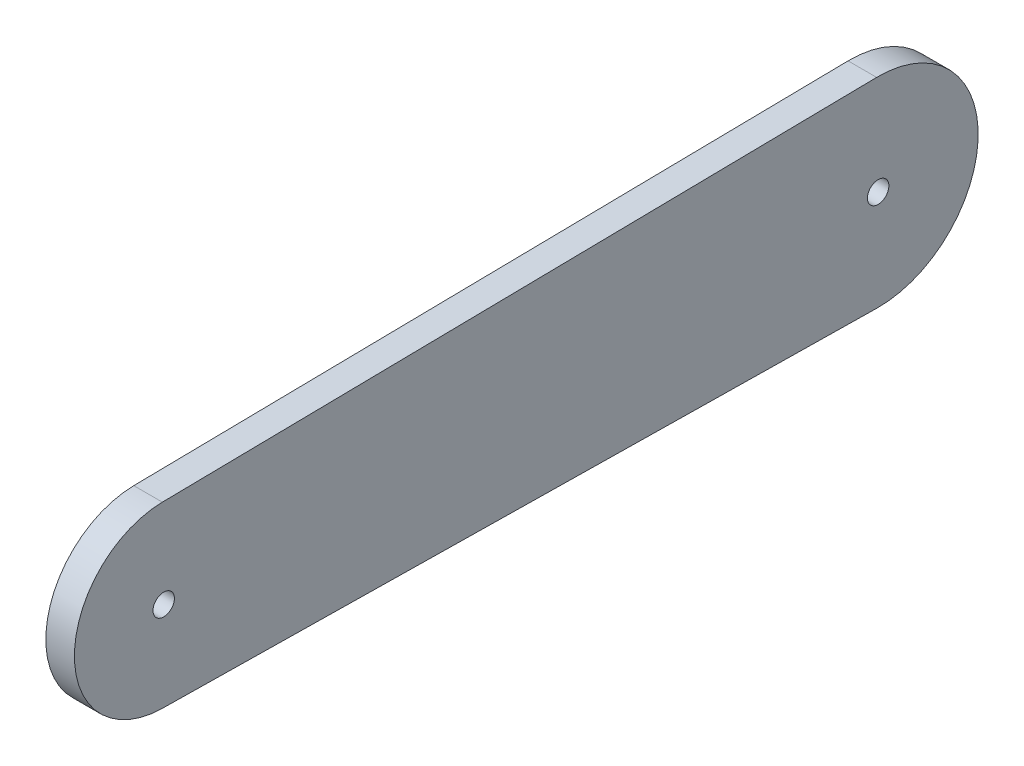
from build123d import *

# Parameters (mm, degrees)
CROQUIS1_R              = 1.5
SALIENTE_EXTRUIR1_DEPTH = 4


with BuildPart() as part:
    # Croquis1 → Saliente-Extruir1 (new body)
    with BuildSketch(Plane(origin=(0, 0, 0), x_dir=(0, 0, -1), z_dir=(1, 0, 0))):
        with BuildLine():
            Line((-100.1875, 12.498593671), (-0.21, 13.998424911))
            ThreePointArc((-0.21, 13.998424911), (14, 0), (-0.21, -13.998424911))
            Line((-0.21, -13.998424911), (-100.1875, -12.498593671))
            ThreePointArc((-100.1875, -12.498593671), (-112.5, 0), (-100.1875, 12.498593671))
        make_face()
        Circle(CROQUIS1_R, mode=Mode.SUBTRACT)
        with Locations((-100, 0)):
            Circle(CROQUIS1_R, mode=Mode.SUBTRACT)
    extrude(amount=SALIENTE_EXTRUIR1_DEPTH)


solid = part.part
